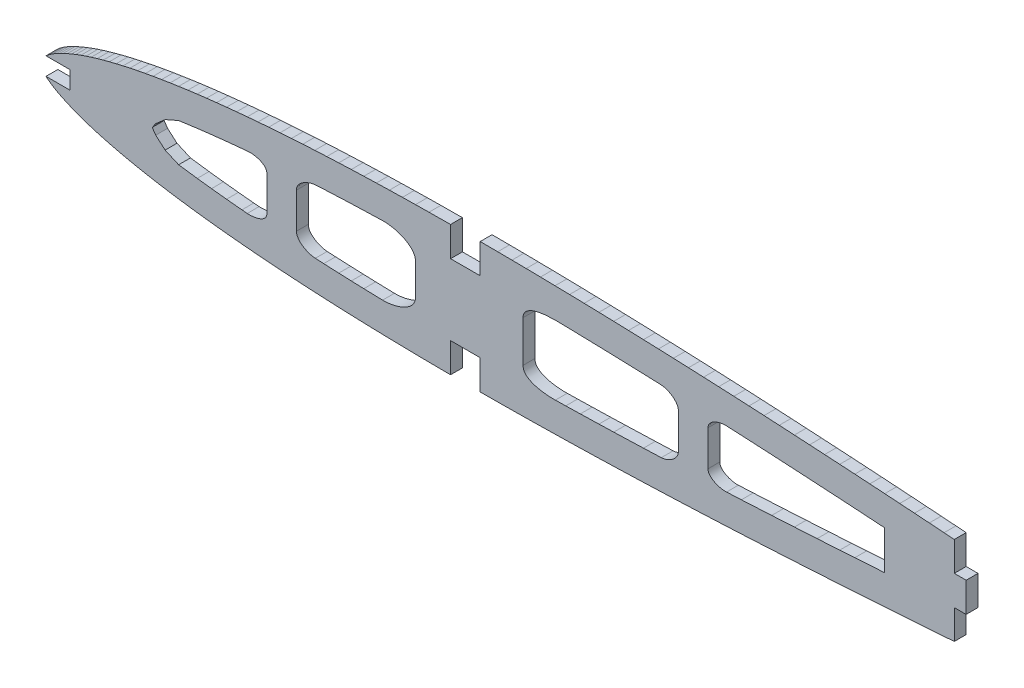
from build123d import *

# Parameters (mm, degrees)
EXTRUDE_1_DEPTH = 2


with BuildPart() as part:
    # Model → 凸台-拉伸1 (new body)
    with BuildSketch(Plane.XY):
        Polygon((365.15593908, -97.397254948), (369.216384424, -97.397254948), (369.216384424, -100.397254948), (365.15593908, -100.397254948), (365.178384424, -100.418254948), (365.561384424, -100.734254948), (365.963384424, -101.027254948), (366.379384424, -101.299254948), (366.925384424, -101.620254948), (367.484384424, -101.915254948), (368.052384424, -102.193254948), (368.758384424, -102.517254948), (369.471384424, -102.823254948), (370.191384424, -103.111254948), (371.050384424, -103.431254948), (371.916384424, -103.729254948), (372.789384424, -104.010254948), (373.800384424, -104.313254948), (374.816384424, -104.598254948), (375.836384424, -104.867254948), (376.993384424, -105.154254948), (378.154384424, -105.425254948), (379.318384424, -105.680254948), (380.617384424, -105.947254948), (381.918384424, -106.198254948), (383.223384424, -106.434254948), (384.657384424, -106.679254948), (386.093384424, -106.909254948), (387.532384424, -107.125254948), (389.097384424, -107.346254948), (390.664384424, -107.552254948), (392.233384424, -107.746254948), (393.923384424, -107.940254948), (395.614384424, -108.121254948), (397.306384424, -108.290254948), (399.113384424, -108.458254948), (400.921384424, -108.614254948), (402.730384424, -108.759254948), (404.647384424, -108.900254948), (406.564384424, -109.029254948), (408.482384424, -109.147254948), (410.502384424, -109.260254948), (412.522384424, -109.361254948), (414.543384424, -109.452254948), (416.657384424, -109.537254948), (418.771384424, -109.612254948), (420.886384424, -109.677254948), (423.086384424, -109.735254948), (425.286384424, -109.783254948), (427.486384424, -109.821254948), (429.765384424, -109.851254948), (433.406384424, -109.880254948), (433.412384424, -104.880254948), (438.412384424, -104.886254948), (438.406384424, -109.886254948), (441.360384424, -109.872254948), (443.766384424, -109.852254948), (446.170384424, -109.823254948), (448.576384424, -109.787254948), (451.031384424, -109.742254948), (453.485384424, -109.690254948), (455.940384424, -109.631254948), (458.436384424, -109.564254948), (460.931384424, -109.491254948), (463.426384424, -109.411254948), (465.952384424, -109.323254948), (468.476384424, -109.230254948), (471.001384424, -109.130254948), (473.547384424, -109.024254948), (476.092384424, -108.913254948), (478.638384424, -108.796254948), (481.194384424, -108.672254948), (483.748384424, -108.543254948), (486.303384424, -108.407254948), (488.858384424, -108.266254948), (491.413384424, -108.120254948), (493.968384424, -107.970254948), (496.514384424, -107.819254948), (499.059384424, -107.665254948), (501.605384424, -107.506254948), (504.131384424, -107.343254948), (506.655384424, -107.175254948), (509.180384424, -107.003254948), (511.676384424, -106.831254948), (514.171384424, -106.655254948), (516.666384424, -106.476254948), (518.390324675, -106.34985607), (518.390324675, -101.397254948), (520.390324675, -101.397254948), (520.390324675, -98.897254948), (520.390324675, -96.397254948), (518.390324675, -96.397254948), (518.390324675, -91.44395161), (516.666384424, -91.318254948), (514.171384424, -91.139254948), (511.676384424, -90.963254948), (509.180384424, -90.790254948), (506.655384424, -90.618254948), (504.131384424, -90.450254948), (501.605384424, -90.287254948), (499.059384424, -90.128254948), (496.514384424, -89.974254948), (493.968384424, -89.823254948), (491.413384424, -89.674254948), (488.858384424, -89.528254948), (486.303384424, -89.386254948), (483.748384424, -89.251254948), (481.194384424, -89.121254948), (478.638384424, -88.998254948), (476.092384424, -88.881254948), (473.547384424, -88.769254948), (471.001384424, -88.663254948), (468.476384424, -88.564254948), (465.952384424, -88.470254948), (463.426384424, -88.383254948), (460.931384424, -88.303254948), (458.436384424, -88.230254948), (455.940384424, -88.163254948), (453.485384424, -88.104254948), (451.031384424, -88.052254948), (448.576384424, -88.007254948), (446.170384424, -87.970254948), (443.766384424, -87.942254948), (441.360384424, -87.921254948), (438.406384424, -87.908254948), (438.410384424, -92.908254948), (433.410384424, -92.914254948), (433.406384424, -87.914254948), (429.765384424, -87.942254948), (427.486384424, -87.972254948), (425.286384424, -88.011254948), (423.086384424, -88.059254948), (420.886384424, -88.117254948), (418.771384424, -88.182254948), (416.657384424, -88.256254948), (414.543384424, -88.341254948), (412.522384424, -88.432254948), (410.502384424, -88.534254948), (408.482384424, -88.646254948), (406.564384424, -88.764254948), (404.647384424, -88.894254948), (402.730384424, -89.035254948), (400.921384424, -89.179254948), (399.113384424, -89.335254948), (397.306384424, -89.503254948), (395.614384424, -89.673254948), (393.923384424, -89.854254948), (392.233384424, -90.048254948), (390.664384424, -90.241254948), (389.097384424, -90.448254948), (387.532384424, -90.668254948), (386.093384424, -90.885254948), (384.657384424, -91.115254948), (383.223384424, -91.359254948), (381.918384424, -91.596254948), (380.617384424, -91.847254948), (379.318384424, -92.114254948), (378.154384424, -92.369254948), (376.993384424, -92.640254948), (375.836384424, -92.927254948), (374.816384424, -93.196254948), (373.800384424, -93.480254948), (372.789384424, -93.784254948), (371.916384424, -94.064254948), (371.050384424, -94.363254948), (370.191384424, -94.682254948), (369.471384424, -94.971254948), (368.758384424, -95.277254948), (368.052384424, -95.600254948), (367.484384424, -95.878254948), (366.925384424, -96.174254948), (366.379384424, -96.494254948), (365.963384424, -96.767254948), (365.561384424, -97.060254948), (365.178384424, -97.376254948), align=None)
        with BuildLine():
            Line((387.532384424, -95.668254948), (390.664384424, -95.241254948))
            Line((390.664384424, -95.241254948), (393.078384424, -94.951254948))
            Line((393.078384424, -94.951254948), (395.614384424, -94.673254948))
            Line((395.614384424, -94.673254948), (398.209884424, -94.419254948))
            Line((398.209884424, -94.419254948), (399.256008395, -94.326660534))
            add(Edge.make_bspline(
                [(399.256008395, -94.326660534), (400.425031433, -94.223188091), (402.407059943, -94.723661574), (402.407059943, -95.897254948)],
                knots=[0, 0, 0, 0, 3.520780123, 3.520780123, 3.520780123, 3.520780123], degree=3))
            Line((402.407059943, -95.897254948), (402.407059943, -101.897254948))
            add(Edge.make_bspline(
                [(399.107567803, -103.454710604), (400.319033115, -103.561939693), (402.407059943, -103.113456526), (402.407059943, -101.897254948)],
                knots=[0, 0, 0, 0, 3.648604734, 3.648604734, 3.648604734, 3.648604734], degree=3))
            Line((399.107567803, -103.454710604), (398.209884424, -103.375254948))
            Line((398.209884424, -103.375254948), (395.614384424, -103.121254948))
            Line((395.614384424, -103.121254948), (393.078384424, -102.843254948))
            Line((393.078384424, -102.843254948), (390.664384424, -102.553254948))
            Line((390.664384424, -102.553254948), (387.532384424, -102.126254948))
            Line((387.532384424, -102.126254948), (385.253151647, -101.124313558))
            Line((385.253151647, -101.124313558), (383.671211695, -99.742297538))
            Line((383.671211695, -99.742297538), (383.077988193, -98.897254948))
            Line((383.077988193, -98.897254948), (383.671211695, -98.052212358))
            Line((383.671211695, -98.052212358), (385.253151647, -96.670196337))
            Line((385.253151647, -96.670196337), (387.532384424, -95.668254948))
        make_face(mode=Mode.SUBTRACT)
        with BuildLine():
            Line((410.750141724, -93.524244431), (412.007899023, -93.458233914))
            Line((412.007899023, -93.458233914), (414.988545957, -93.323355832))
            Line((414.988545957, -93.323355832), (416.657384424, -93.256254948))
            Line((416.657384424, -93.256254948), (418.771384424, -93.182254948))
            Line((418.771384424, -93.182254948), (421.986384424, -93.088254948))
            add(Edge.make_bspline(
                [(421.986384424, -93.088254948), (424.099590721, -93.026469134), (427.486384424, -94.132487735), (427.486384424, -96.246597084)],
                knots=[0, 0, 0, 0, 6.342328047, 6.342328047, 6.342328047, 6.342328047], degree=3))
            Line((427.486384424, -96.246597084), (427.486384424, -101.547954948))
            add(Edge.make_bspline(
                [(421.934277608, -104.704731451), (424.062299307, -104.766950437), (427.486384424, -103.67688603), (427.486384424, -101.547954948)],
                knots=[0, 0, 0, 0, 6.386793248, 6.386793248, 6.386793248, 6.386793248], degree=3))
            Line((421.934277608, -104.704731451), (418.771384424, -104.612254948))
            Line((418.771384424, -104.612254948), (416.657384424, -104.538254948))
            Line((416.657384424, -104.538254948), (414.543384424, -104.453254948))
            Line((414.543384424, -104.453254948), (412.007899023, -104.336275982))
            Line((412.007899023, -104.336275982), (410.590931808, -104.261909696))
            add(Edge.make_bspline(
                [(410.590931808, -104.261909696), (409.270770722, -104.192624059), (407.407059943, -103.219232933), (407.407059943, -101.897254948)],
                knots=[0, 0, 0, 0, 3.965933954, 3.965933954, 3.965933954, 3.965933954], degree=3))
            Line((407.407059943, -101.897254948), (407.407059943, -95.897254948))
            add(Edge.make_bspline(
                [(410.750141724, -93.524244431), (409.385459952, -93.595866634), (407.407059943, -94.530695005), (407.407059943, -95.897254948)],
                knots=[0, 0, 0, 0, 4.099679829, 4.099679829, 4.099679829, 4.099679829], degree=3))
        make_face(mode=Mode.SUBTRACT)
        with BuildLine():
            Line((451.320064617, -93.060127348), (452.836244811, -93.090499748))
            Line((452.836244811, -93.090499748), (455.299671222, -93.147856952))
            Line((455.299671222, -93.147856952), (458.436384424, -93.230254948))
            Line((458.436384424, -93.230254948), (460.931384424, -93.303254948))
            Line((460.931384424, -93.303254948), (465.952384424, -93.470254948))
            Line((465.952384424, -93.470254948), (468.858180977, -93.580378229))
            add(Edge.make_bspline(
                [(468.858180977, -93.580378229), (470.115446563, -93.628025822), (471.837940312, -94.639086816), (471.837940312, -95.897254948)],
                knots=[0, 0, 0, 0, 3.774504395, 3.774504395, 3.774504395, 3.774504395], degree=3))
            Line((471.837940312, -95.897254948), (471.837940312, -101.897254948))
            add(Edge.make_bspline(
                [(468.955890911, -104.210428675), (470.186852362, -104.163777951), (471.837940312, -103.129100061), (471.837940312, -101.897254948)],
                knots=[0, 0, 0, 0, 3.695535339, 3.695535339, 3.695535339, 3.695535339], degree=3))
            Line((468.955890911, -104.210428675), (465.952384424, -104.324254948))
            Line((465.952384424, -104.324254948), (460.931384424, -104.491254948))
            Line((460.931384424, -104.491254948), (458.436384424, -104.564254948))
            Line((458.436384424, -104.564254948), (455.299671222, -104.646652943))
            Line((455.299671222, -104.646652943), (452.836244811, -104.704010147))
            Line((452.836244811, -104.704010147), (451.086109909, -104.739069171))
            add(Edge.make_bspline(
                [(445.634956017, -102.380454948), (445.634956017, -104.360301738), (449.106660244, -104.778721871), (451.086109909, -104.739069171)],
                knots=[0, 0, 0, 0, 5.93954037, 5.93954037, 5.93954037, 5.93954037], degree=3))
            Line((445.634956017, -102.380454948), (445.634956017, -95.414080797))
            add(Edge.make_bspline(
                [(445.634956017, -95.414080797), (445.634956017, -93.363022625), (449.269417854, -93.019048415), (451.320064617, -93.060127348)],
                knots=[0, 0, 0, 0, 6.153174517, 6.153174517, 6.153174517, 6.153174517], degree=3))
        make_face(mode=Mode.SUBTRACT)
        with BuildLine():
            Line((479.918384424, -94.063004948), (482.471384424, -94.186254948))
            Line((482.471384424, -94.186254948), (487.580884424, -94.457254948))
            Line((487.580884424, -94.457254948), (491.413384424, -94.674254948))
            Line((491.413384424, -94.674254948), (495.241384424, -94.898754948))
            Line((495.241384424, -94.898754948), (499.059384424, -95.128254948))
            Line((499.059384424, -95.128254948), (501.605384424, -95.287254948))
            Line((501.605384424, -95.287254948), (506.655384424, -95.618254948))
            Line((506.655384424, -95.618254948), (506.655384424, -102.176254948))
            Line((506.655384424, -102.176254948), (501.605384424, -102.507254948))
            Line((501.605384424, -102.507254948), (499.059384424, -102.666254948))
            Line((499.059384424, -102.666254948), (495.241384424, -102.895754948))
            Line((495.241384424, -102.895754948), (491.413384424, -103.120254948))
            Line((491.413384424, -103.120254948), (487.580884424, -103.337254948))
            Line((487.580884424, -103.337254948), (482.471384424, -103.608254948))
            Line((482.471384424, -103.608254948), (479.965627503, -103.729224215))
            add(Edge.make_bspline(
                [(479.965627503, -103.729224215), (478.758795619, -103.78748588), (476.837940312, -103.105492349), (476.837940312, -101.897254948)],
                knots=[0, 0, 0, 0, 3.624712204, 3.624712204, 3.624712204, 3.624712204], degree=3))
            Line((476.837940312, -101.897254948), (476.837940312, -95.897254948))
            add(Edge.make_bspline(
                [(479.918384424, -94.063004948), (478.724710277, -94.005378493), (476.837940312, -94.702190608), (476.837940312, -95.897254948)],
                knots=[0, 0, 0, 0, 3.58519302, 3.58519302, 3.58519302, 3.58519302], degree=3))
        make_face(mode=Mode.SUBTRACT)
    extrude(amount=EXTRUDE_1_DEPTH)


solid = part.part
